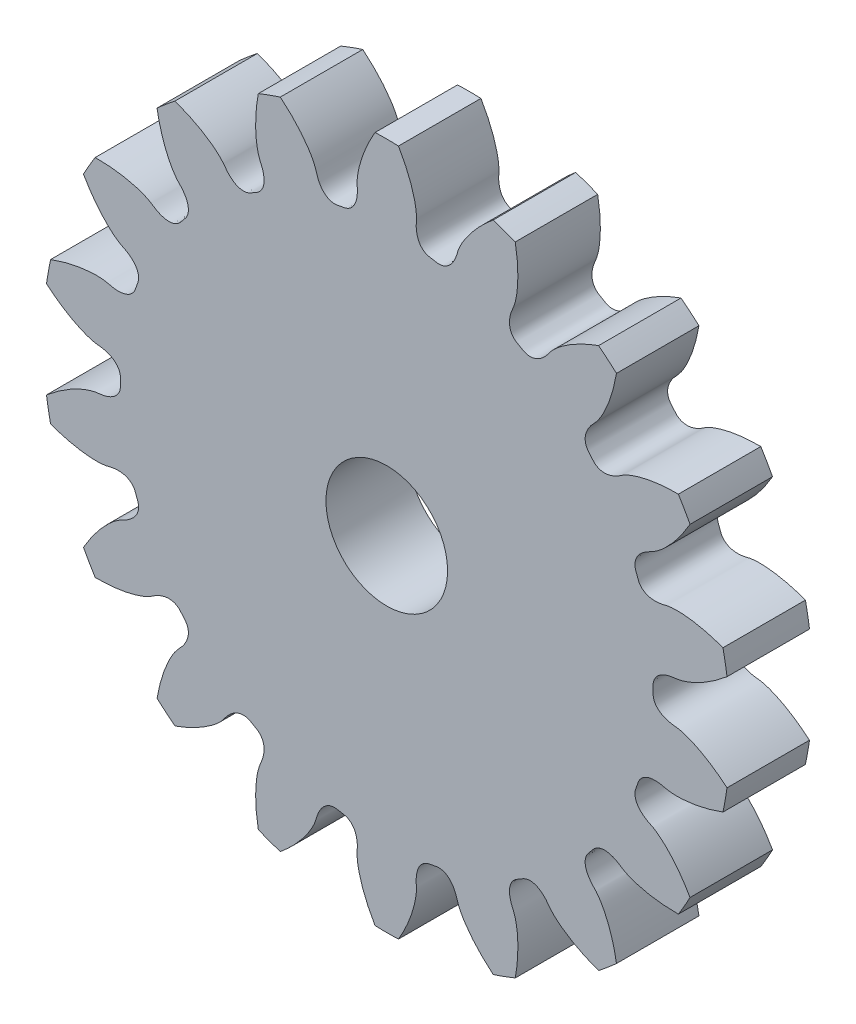
from build123d import *

# Parameters (mm, degrees)
SKETCHREVOLVESPURGEAR1_W       = 4
SKETCHREVOLVESPURGEAR1_H       = 16.666666667
TOOTHEXTRUDECUTSPURGEAR1_DEPTH = 9.525
PATTERNSPURGEAR1_COUNT         = 18
BOREREVOLVESKETCH_W            = 19.05
BOREREVOLVESKETCH_H            = 2.95


with BuildPart() as part:
    # SketchRevolveSpurGear1 → SpurGear1 (revolve)
    with BuildSketch(Plane(origin=(0, 0, 0), x_dir=(0, 0, -1), z_dir=(1, 0, 0))):
        with Locations((0, 8.333333334)):
            Rectangle(SKETCHREVOLVESPURGEAR1_W, SKETCHREVOLVESPURGEAR1_H)
    revolve(axis=Axis((0, 0, 0), (0, 0, -1)))

    # SketchToothSpurGear1 → ToothExtrudeCutSpurGear1 (cut, symmetric)
    with BuildSketch(Plane.XY):
        with BuildLine():
            ThreePointArc((16.577538036, 2.397442942), (16.75, 0), (16.577538036, -2.397442942))
            add(Edge.make_bspline(
                [(16.577538036, -2.397442942), (16.374498798, -2.221463075), (16.101029706, -2.004673022), (15.751997223, -1.764612508), (15.562506429, -1.643045597), (15.381686095, -1.535062353), (15.210200236, -1.439974059), (15.048677102, -1.357062905), (14.897708322, -1.285584675), (14.757847791, -1.224770128), (14.62961071, -1.173826636), (14.513472649, -1.131940154), (14.409868772, -1.098276073), (14.319192843, -1.071983733), (14.241797192, -1.052190021), (14.177990136, -1.038025047), (14.128040759, -1.02855872), (14.092164773, -1.022969873), (14.070554509, -1.02017597), (13.985211331, -1.012434351), (13.877646229, -1.00139864), (13.745783192, -0.976090217), (13.661934324, -0.956243186), (13.581242655, -0.932921148), (13.50351504, -0.905968384), (13.428541759, -0.875031649), (13.356102352, -0.839609179), (13.28600701, -0.798972004), (13.218173364, -0.752109778), (13.152767181, -0.6976825), (13.090441933, -0.634035397), (13.032654953, -0.559376387), (12.982095559, -0.472232006), (12.942483692, -0.372361621), (12.921165545, -0.270508851), (12.912338502, -0.145204858), (12.919512079, 0), (12.912338502, 0.145204858), (12.921165545, 0.270508851), (12.942483692, 0.372361621), (12.982095559, 0.472232006), (13.032654953, 0.559376387), (13.090441933, 0.634035397), (13.152767181, 0.6976825), (13.218173364, 0.752109778), (13.28600701, 0.798972004), (13.356102352, 0.839609179), (13.428541759, 0.875031649), (13.50351504, 0.905968384), (13.581242655, 0.932921148), (13.661934324, 0.956243186), (13.745783192, 0.976090217), (13.877646229, 1.00139864), (13.985211331, 1.012434351), (14.070554509, 1.02017597), (14.092164773, 1.022969873), (14.128040759, 1.02855872), (14.177990136, 1.038025047), (14.241797192, 1.052190021), (14.319192843, 1.071983733), (14.409868772, 1.098276073), (14.513472649, 1.131940154), (14.62961071, 1.173826636), (14.757847791, 1.224770128), (14.897708322, 1.285584675), (15.048677102, 1.357062905), (15.210200236, 1.439974059), (15.381686095, 1.535062353), (15.562506429, 1.643045597), (15.751997223, 1.764612508), (16.101029706, 2.004673022), (16.374498798, 2.221463075), (16.577538036, 2.397442942)],
                knots=[0, 0, 0, 0, 0.086714261, 0.112496448, 0.136716077, 0.15937315, 0.180467667, 0.199999626, 0.217969029, 0.234375875, 0.249220165, 0.262501898, 0.274221074, 0.284377694, 0.292971757, 0.300003263, 0.305472213, 0.309378607, 0.311722446, 0.312503736, 0.337039304, 0.346571131, 0.355826521, 0.364844172, 0.373671863, 0.382368796, 0.391008388, 0.399681316, 0.40849819, 0.417590416, 0.427106222, 0.437196802, 0.447986267, 0.459523071, 0.471725612, 0.481411914, 0.5, 0.518588086, 0.528274388, 0.540476929, 0.552013733, 0.562803198, 0.572893778, 0.582409584, 0.59150181, 0.600318684, 0.608991612, 0.617631204, 0.626328137, 0.635155828, 0.644173479, 0.653428869, 0.662960696, 0.687496264, 0.688277554, 0.690621393, 0.694527787, 0.699996737, 0.707028243, 0.715622306, 0.725778926, 0.737498102, 0.750779835, 0.765624125, 0.782030971, 0.800000374, 0.819532333, 0.84062685, 0.863283923, 0.887503552, 0.913285739, 1, 1, 1, 1], degree=3))
        make_face()
    toothextrudecutspurgear1 = extrude(amount=TOOTHEXTRUDECUTSPURGEAR1_DEPTH, both=True, mode=Mode.SUBTRACT)

    # PatternSpurGear1: ToothExtrudeCutSpurGear1 ×18 about axis
    patternspurgear1_axis = Axis((0, 0, 55), (0, 0, -1))
    for i in range(1, PATTERNSPURGEAR1_COUNT):
        add(toothextrudecutspurgear1.rotate(patternspurgear1_axis, i * 360 / PATTERNSPURGEAR1_COUNT), mode=Mode.SUBTRACT)

    # BoreRevolveSketch → BoreRevolveCut (revolve, cut)
    with BuildSketch(Plane(origin=(0, 0, 0), x_dir=(0, 0, -1), z_dir=(1, 0, 0))):
        with Locations((0, 1.475)):
            Rectangle(BOREREVOLVESKETCH_W, BOREREVOLVESKETCH_H)
    revolve(axis=Axis((0, 0, 0), (0, 0, -1)), mode=Mode.SUBTRACT)


solid = part.part
